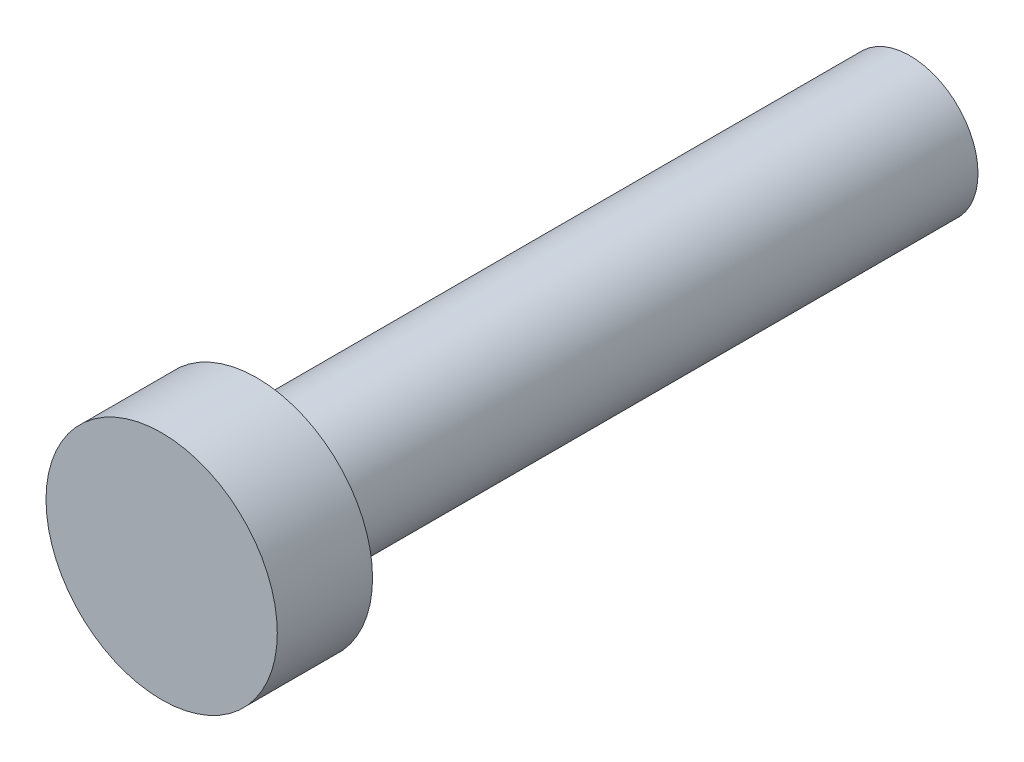
from build123d import *

# Parameters (mm, degrees)
SKETCH1_R           = 2.5
BOSS_EXTRUDE1_DEPTH = 24
SKETCH2_R           = 4.25
BOSS_EXTRUDE2_DEPTH = 3.5


with BuildPart() as part:
    # Sketch1 → Boss-Extrude1 (new body)
    with BuildSketch(Plane.XY.offset(338.5)):
        with Locations((300, 40)):
            Circle(SKETCH1_R)
    extrude(amount=BOSS_EXTRUDE1_DEPTH)

    # Sketch2 → Boss-Extrude2 (add)
    with BuildSketch(Plane.XY.offset(362.5)):
        with Locations((300, 40)):
            Circle(SKETCH2_R)
    extrude(amount=BOSS_EXTRUDE2_DEPTH)


solid = part.part
